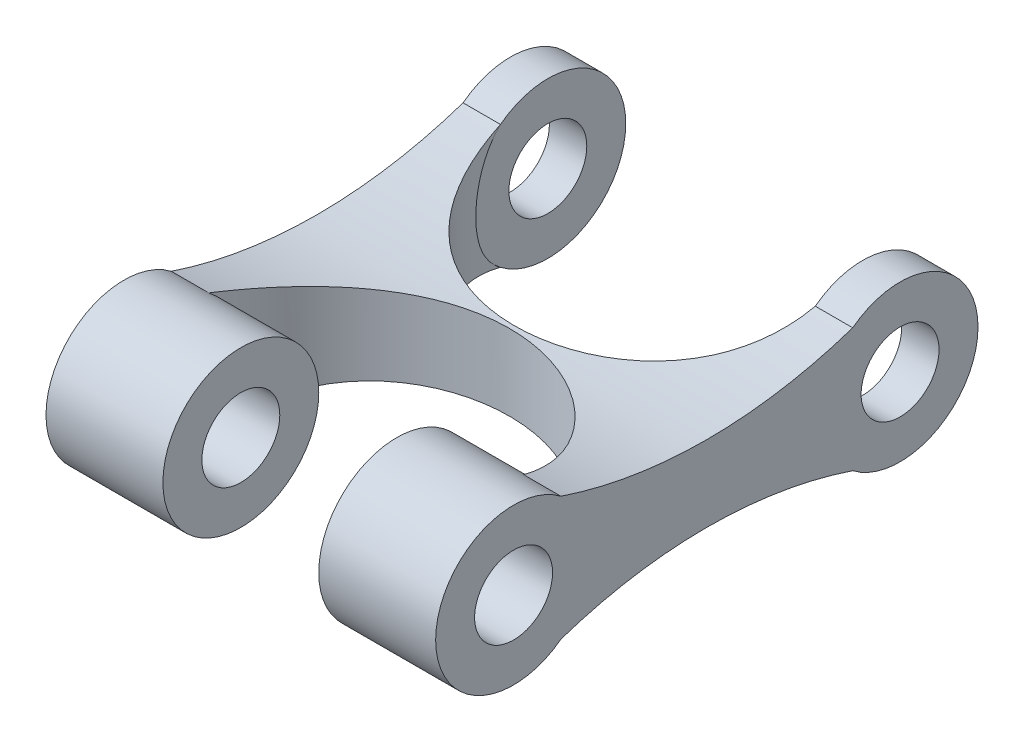
from build123d import *

# Parameters (mm, degrees)
SKETCH2_R               = 2.5
SKETCH2_R_2             = 1.25
BOSS_EXTRUDE1_DEPTH     = 6.25
BOSS_EXTRUDE1_2_DEPTH   = 6.25
SKETCH3_R               = 2.5
SKETCH3_R_2             = 1.25
CUT_EXTRUDE1_DEPTH      = 5.05
BOSS_EXTRUDE2_DEPTH     = 6.25
CUT_EXTRUDE2_DEPTH      = 11.999394484
CUT_EXTRUDE2_DEPTH_BACK = 11.999394484
SKETCH6_R               = 1.25
BOSS_EXTRUDE3_DEPTH     = 11.001
SKETCH7_R               = 2.5
SKETCH7_R_2             = 1.25
CUT_EXTRUDE3_DEPTH      = 2.5
SCALE1_SCALE            = 1.5


with BuildPart() as part:
    # Sketch2 → Boss-Extrude1 (new, symmetric)
    with BuildSketch(Plane(origin=(0, 0, 0), x_dir=(0, 0, -1), z_dir=(1, 0, 0))):
        with Locations((6.1990907, 0)):
            Circle(SKETCH2_R)
        with Locations((6.1990907, 0)):
            Circle(SKETCH2_R_2, mode=Mode.SUBTRACT)
    extrude(amount=BOSS_EXTRUDE1_DEPTH, both=True)


with BuildPart() as body_2:
    # Sketch2 → Boss-Extrude1 2 (new, symmetric)
    with BuildSketch(Plane(origin=(0, 0, 0), x_dir=(0, 0, -1), z_dir=(1, 0, 0))):
        with Locations((-6.1990907, 0)):
            Circle(SKETCH2_R)
        with Locations((-6.1990907, 0)):
            Circle(SKETCH2_R_2, mode=Mode.SUBTRACT)
    extrude(amount=BOSS_EXTRUDE1_2_DEPTH, both=True)


with BuildPart() as cut_extrude1_tool:
    # Sketch3 → Cut-Extrude1 (new, symmetric)
    # profile 1 of 2: a face of its own
    with BuildSketch(Plane(origin=(0, 0, 0), x_dir=(0, 0, -1), z_dir=(1, 0, 0))):
        with Locations((6.1990907, 0)):
            Circle(SKETCH3_R)
        with Locations((6.1990907, 0)):
            Circle(SKETCH3_R_2, mode=Mode.SUBTRACT)
    # profile 2 of 2: a face of its own
    with BuildSketch(Plane(origin=(0, 0, 0), x_dir=(0, 0, -1), z_dir=(1, 0, 0))):
        with Locations((-6.1990907, 0)):
            Circle(SKETCH3_R)
        with Locations((-6.1990907, 0)):
            Circle(SKETCH3_R_2, mode=Mode.SUBTRACT)
    extrude(amount=CUT_EXTRUDE1_DEPTH, both=True)


with BuildPart() as part_1:
    add(part.part)

    # Cut-Extrude1: cut by cut_extrude1_tool
    add(cut_extrude1_tool.part, mode=Mode.SUBTRACT)


with BuildPart() as body_2_1:
    add(body_2.part)

    # Cut-Extrude1: cut by cut_extrude1_tool
    add(cut_extrude1_tool.part, mode=Mode.SUBTRACT)


with BuildPart() as cut_extrude1_piece_1:
    # of the separate pieces the step leaves, piece 1, a body of its own (cut_extrude1_pieces)
    add(part_1.part.solids().sort_by_distance((-6.25, 0, -8.6990907))[0])



with BuildPart() as cut_extrude1_piece_2:
    # of the separate pieces the step leaves, piece 2, a body of its own (cut_extrude1_pieces)
    add(part_1.part.solids().sort_by_distance((5.05, 0, -8.6990907))[0])


with BuildPart() as cut_extrude1_piece_1_of_body_2:
    # of the separate pieces the step leaves, piece 1, a body of its own (cut_extrude1_pieces_of_body_2)
    add(body_2_1.part.solids().sort_by_distance((-6.25, 0, 3.6990907))[0])


with BuildPart() as cut_extrude1_piece_2_of_body_2:
    # of the separate pieces the step leaves, piece 2, a body of its own (cut_extrude1_pieces_of_body_2)
    add(body_2_1.part.solids().sort_by_distance((5.05, 0, 3.6990907))[0])


with BuildPart() as cut_extrude1_piece_1_1:
    add(cut_extrude1_piece_1.part)

    add(cut_extrude1_piece_2.part)  # Boss-Extrude2 merges Cut-Extrude1 piece 2

    add(cut_extrude1_piece_1_of_body_2.part)  # Boss-Extrude2 merges Cut-Extrude1 piece 1 of body 2

    add(cut_extrude1_piece_2_of_body_2.part)  # Boss-Extrude2 merges Cut-Extrude1 piece 2 of body 2
    # Sketch4 → Boss-Extrude2 (add, symmetric)
    with BuildSketch(Plane(origin=(0, 0, 0), x_dir=(0, 0, -1), z_dir=(1, 0, 0))):
        with BuildLine():
            ThreePointArc((4.67985349, 1.985426478), (3.6990907, 0), (4.67985349, -1.985426478))
            ThreePointArc((4.67985349, -1.985426478), (0, -1.218902019), (-4.67985349, -1.985426478))
            ThreePointArc((-4.67985349, -1.985426478), (-3.6990907, 0), (-4.67985349, 1.985426478))
            ThreePointArc((-4.67985349, 1.985426478), (0, 1.218902019), (4.67985349, 1.985426478))
        make_face()
    extrude(amount=BOSS_EXTRUDE2_DEPTH, both=True)

    # Sketch5 → Cut-Extrude2 (cut, two sides: drawn at the far end of the back side and taken through both)
    with BuildSketch(Plane(origin=(0, 0, 0), x_dir=(1, 0, 0), z_dir=(0, 1, 0)).offset(-CUT_EXTRUDE2_DEPTH_BACK)):
        with BuildLine():
            Line((-5.05, 4.67985349), (5.05, 4.67985349))
            ThreePointArc((5.05, 4.67985349), (0, 0.076203165), (-5.05, 4.67985349))
        make_face()
        with BuildLine():
            Line((5.05, -4.67985349), (-5.05, -4.67985349))
            ThreePointArc((-5.05, -4.67985349), (0, -0.076203165), (5.05, -4.67985349))
        make_face()
    extrude(amount=CUT_EXTRUDE2_DEPTH + CUT_EXTRUDE2_DEPTH_BACK, mode=Mode.SUBTRACT)

    # Sketch6 → Boss-Extrude3 (add)
    with BuildSketch(Plane(origin=(-5.05, 0, 0), x_dir=(0, 0, -1), z_dir=(1, 0, 0))):
        with BuildLine():
            ThreePointArc((-4.67985349, 1.985426478), (-8.6990907, 0), (-4.67985349, -1.985426478))
            ThreePointArc((-4.67985349, -1.985426478), (-3.6990907, 0), (-4.67985349, 1.985426478))
        make_face()
        with Locations((-6.1990907, 0)):
            Circle(SKETCH6_R, mode=Mode.SUBTRACT)
    extrude(amount=BOSS_EXTRUDE3_DEPTH)

    # Sketch7 → Cut-Extrude3 (cut, symmetric)
    with BuildSketch(Plane(origin=(0, 0, 0), x_dir=(0, 0, -1), z_dir=(1, 0, 0))):
        with Locations(Location((-6.1990907, 0, 0), (0, 0, 52.576985937))):
            Circle(SKETCH7_R)
        with Locations((-6.1990907, 0)):
            Circle(SKETCH7_R_2, mode=Mode.SUBTRACT)
    extrude(amount=CUT_EXTRUDE3_DEPTH, both=True, mode=Mode.SUBTRACT)


with BuildPart() as cut_extrude1_piece_1_2:
    # Scale1: scaled about (-1.86e-07, 9.5e-08, 1.803553273)
    add(cut_extrude1_piece_1_1.part.scale(SCALE1_SCALE).moved(Location((9.3e-08, -4.8e-08, -0.901776636))))


solid = cut_extrude1_piece_1_2.part
